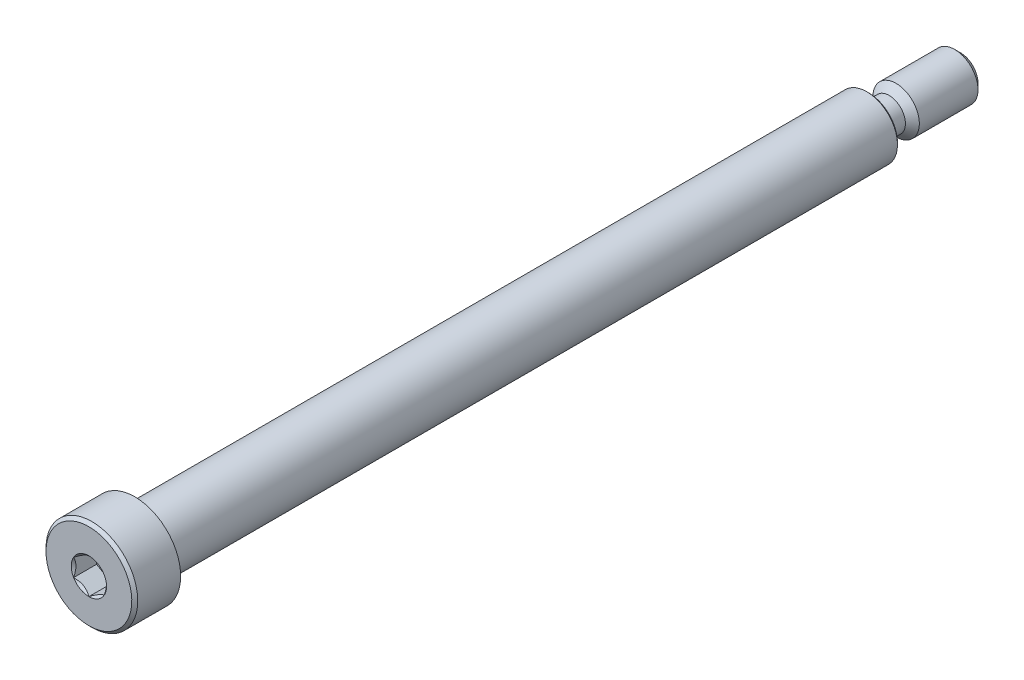
from build123d import *

# Parameters (mm, degrees)
CHAMFER1_SIZE      = 0.60325
CHAMFER2_SIZE      = 0.3095625
CHAMFER3_SIZE      = 0.2032
CUT_EXTRUDE2_DEPTH = 2.38125


with BuildPart() as part:
    # Sketch1 → Revolve1 (revolve)
    with BuildSketch(Plane(origin=(0, 0, 0), x_dir=(0, 0, -1), z_dir=(1, 0, 0))):
        Polygon((0, 4.7625), (4.7625, 4.7625), (4.7625, 3.175), (80.9625, 3.175), (80.9625, 2.413), (90.4875, 2.413), (90.4875, 0), (0, 0), align=None)
    revolve(axis=Axis((0, 0, -90.4875), (0, 0, 1)))

    # Sketch5 → Cut-Revolve1 (revolve, cut)
    with BuildSketch(Plane(origin=(0, 0, 0), x_dir=(0, 0, -1), z_dir=(1, 0, 0))):
        with BuildLine():
            Line((80.9625, 3.175), (84.5566, 3.175))
            Line((84.5566, 3.175), (83.0707, 1.6891))
            Line((83.0707, 1.6891), (81.6864, 1.6891))
            ThreePointArc((81.6864, 1.6891), (81.174525401, 1.901125401), (80.9625, 2.413))
            Line((80.9625, 2.413), (80.9625, 3.175))
        make_face()
    revolve(axis=Axis((0, 0, -90.4875), (0, 0, 1)), mode=Mode.SUBTRACT)

    # Chamfer1
    chamfer1_edges = [part.edges().sort_by_distance(p)[0] for p in [
        (0, -2.413, -90.4875),
    ]]
    chamfer(chamfer1_edges, length=CHAMFER1_SIZE)

    # Chamfer2
    chamfer2_edges = [part.edges().sort_by_distance(p)[0] for p in [
        (0, -4.7625, 0),
    ]]
    chamfer(chamfer2_edges, length=CHAMFER2_SIZE)

    # Chamfer3
    chamfer3_edges = [part.edges().sort_by_distance(p)[0] for p in [
        (0, -3.175, -80.9625),
    ]]
    chamfer(chamfer3_edges, length=CHAMFER3_SIZE)

    # Sketch8 → Cut-Extrude2 (cut)
    with BuildSketch(Plane.XY):
        Polygon((1.5875, 0.916543552), (0, 1.833087105), (-1.5875, 0.916543552), (-1.5875, -0.916543552), (0, -1.833087105), (1.5875, -0.916543552), align=None)
    extrude(amount=-CUT_EXTRUDE2_DEPTH, mode=Mode.SUBTRACT)

    # Cut-Extrude4 cone 1 section (through the dimple's axis) → Cut-Extrude4 (revolve, cut)
    with BuildSketch(Plane(origin=(0, 0, 0), x_dir=(0, -1, 0), z_dir=(1, 0, 0))):
        Polygon((0, 0), (1.833087105, 0), (0, 1.833087105), align=None)
    revolve(axis=Axis((0, 0, 0), (0, 0, -1)), mode=Mode.SUBTRACT)


solid = part.part
